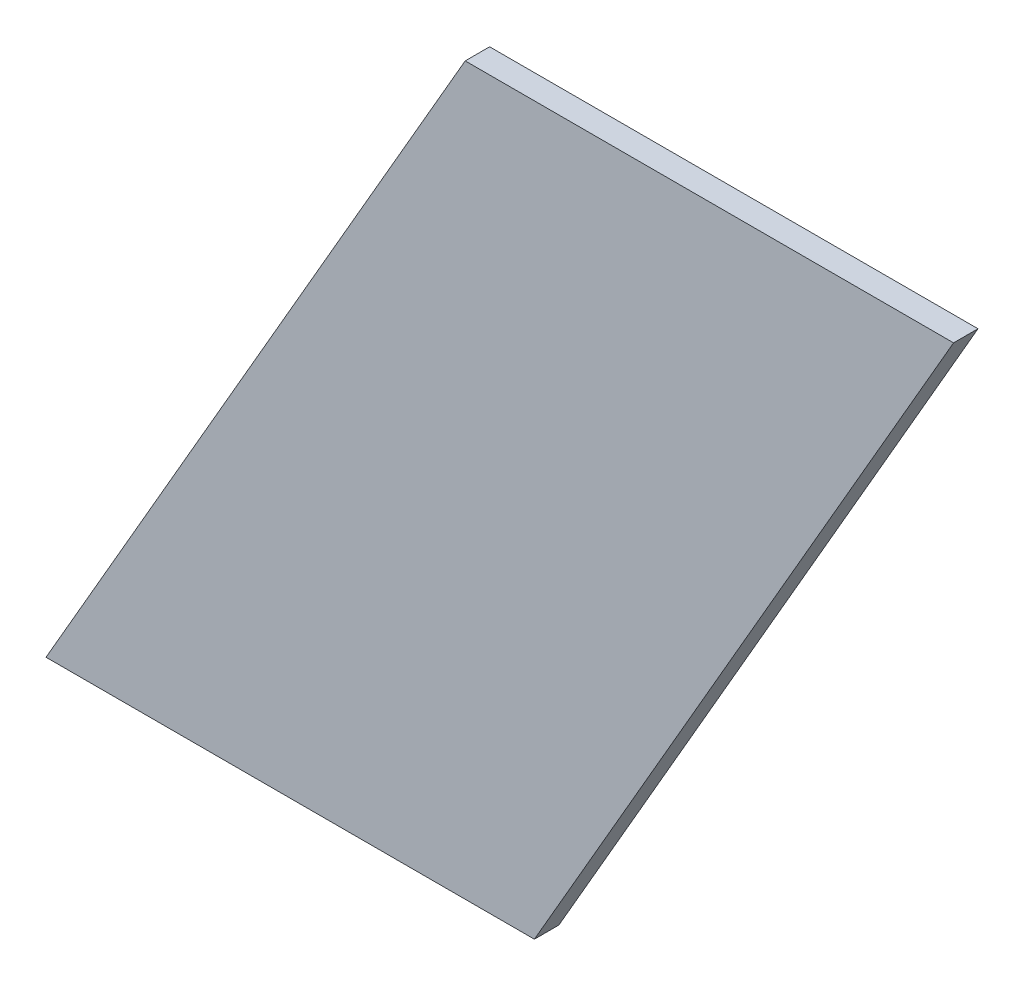
from build123d import *

# Parameters (mm, degrees)
BOSS_EXTRUDE2_DEPTH = 0.015


with BuildPart() as part:
    # Sketch1 → Boss-Extrude2 (new, symmetric)
    with BuildSketch(Plane.XY):
        Polygon((-0.0425, 0.446003083), (0.5575, 0.446003083), (0.0425, -0.446003083), (-0.5575, -0.446003083), align=None)
    extrude(amount=BOSS_EXTRUDE2_DEPTH, both=True)


solid = part.part
